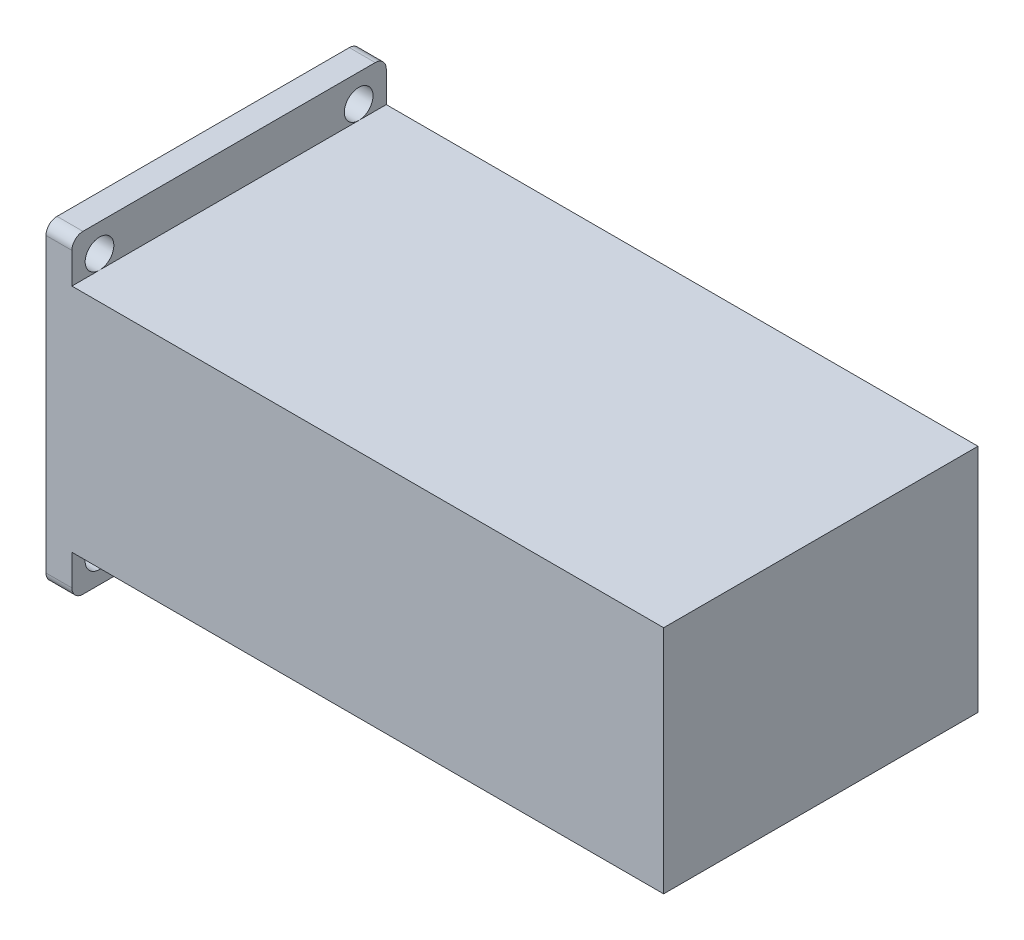
from build123d import *

# Parameters (mm, degrees)
SKETCH_1_W          = 57
SKETCH_1_H          = 57
EXTRUDE_1_DEPTH     = 112
FILLET_1_R          = 2
CUT_EXTRUDE_2_DEPTH = 107.3
SKETCH_6_R          = 4
EXTRUDE_2_DEPTH     = 20
SKETCH_7_W          = 9.44271558
SKETCH_7_H          = 0.5
CUT_EXTRUDE_3_DEPTH = 15
SKETCH_2_R          = 19.05
EXTRUDE_3_DEPTH     = 1.5
SKETCH_8_R          = 2.6
CUT_EXTRUDE_4_DEPTH = 4.7


with BuildPart() as part:
    # 草图1 → 凸台-拉伸1 (new body)
    with BuildSketch(Plane(origin=(0, 0, 0), x_dir=(0, 0, -1), z_dir=(1, 0, 0))):
        Rectangle(SKETCH_1_W, SKETCH_1_H)
    extrude(amount=EXTRUDE_1_DEPTH)

    # 圆角1
    fillet_1_edges = [part.edges().sort_by_distance(p)[0] for p in [
        (56, 28.5, 28.5),
        (56, 28.5, -28.5),
        (56, -28.5, -28.5),
        (56, -28.5, 28.5),
    ]]
    fillet(fillet_1_edges, radius=FILLET_1_R)

    # 草图5 → 切除-拉伸2 (cut)
    with BuildSketch(Plane(origin=(112, 0, 0), x_dir=(0, 0, -1), z_dir=(1, 0, 0))):
        Polygon((-20.9, 20.9), (20.9, 20.9), (28.5, 20.9), (28.5, 28.5), (-28.5, 28.5), (-28.5, 20.9), align=None)
        Polygon((-28.5, -28.5), (28.5, -28.5), (28.5, -20.9), (20.9, -20.9), (-20.9, -20.9), (-28.5, -20.9), align=None)
    extrude(amount=-CUT_EXTRUDE_2_DEPTH, mode=Mode.SUBTRACT)

    # 草图6 → 凸台-拉伸2 (add)
    with BuildSketch(Plane.ZY):
        with Locations(Location((0, 0, 0), (0, 0, 180))):
            Circle(SKETCH_6_R)
    extrude(amount=EXTRUDE_2_DEPTH)

    # 草图7 → 切除-拉伸3 (cut)
    with BuildSketch(Plane.ZY.offset(20)):
        with Locations((0.062351887, 3.75)):
            Rectangle(SKETCH_7_W, SKETCH_7_H)
    extrude(amount=-CUT_EXTRUDE_3_DEPTH, mode=Mode.SUBTRACT)

    # 草图2 → 凸台-拉伸3 (add)
    with BuildSketch(Plane.ZY):
        with Locations(Location((0, 0, 0), (0, 0, 180))):
            Circle(SKETCH_2_R)
    extrude(amount=EXTRUDE_3_DEPTH)

    # 草图8 → 切除-拉伸4 (cut)
    with BuildSketch(Plane.ZY):
        with Locations((-23.5, 23.5)):
            Circle(SKETCH_8_R)
        with Locations((23.5, 23.5)):
            Circle(SKETCH_8_R)
        with Locations((-23.5, -23.5)):
            Circle(SKETCH_8_R)
        with Locations((23.5, -23.5)):
            Circle(SKETCH_8_R)
    extrude(amount=-CUT_EXTRUDE_4_DEPTH, mode=Mode.SUBTRACT)


solid = part.part
